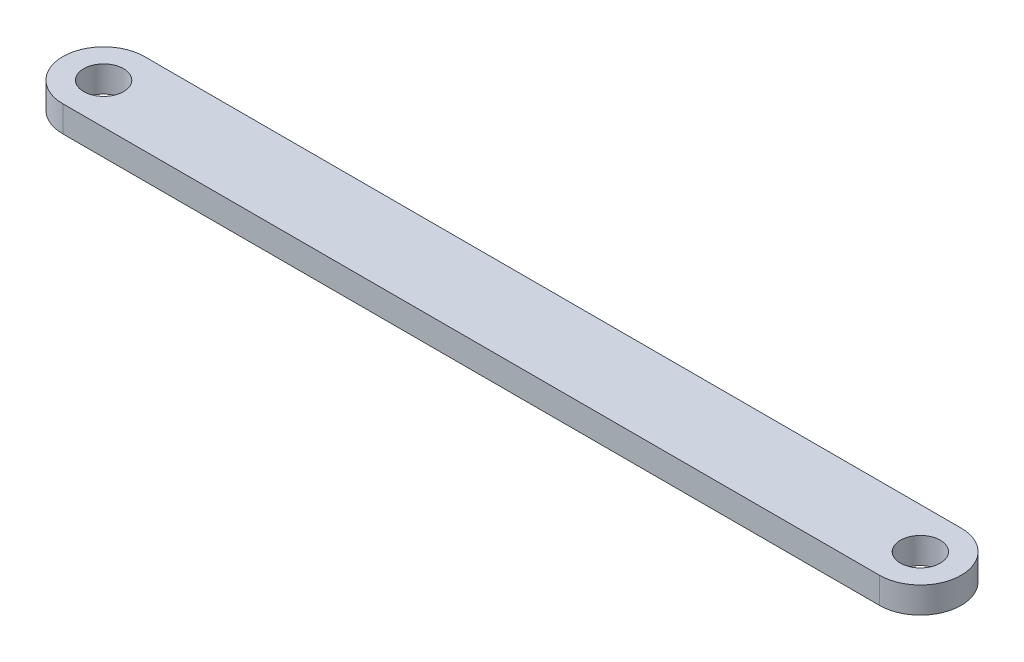
from build123d import *

# Parameters (mm, degrees)
SKETCH_1_R      = 6.1
EXTRUDE_1_DEPTH = 8


with BuildPart() as part:
    # 草图1 → 凸台-拉伸1 (new body)
    with BuildSketch(Plane(origin=(0, 0, 0), x_dir=(1, 0, 0), z_dir=(0, 1, 0))):
        with BuildLine():
            Line((0, 12.5), (250, 12.5))
            ThreePointArc((250, 12.5), (262.5, 0), (250, -12.5))
            Line((250, -12.5), (0, -12.5))
            ThreePointArc((0, -12.5), (-12.5, 0), (0, 12.5))
        make_face()
        with Locations(Location((0, 0, 0), (0, 0, 270))):
            Circle(SKETCH_1_R, mode=Mode.SUBTRACT)
        with Locations(Location((250, 0, 0), (0, 0, 270))):
            Circle(SKETCH_1_R, mode=Mode.SUBTRACT)
    extrude(amount=EXTRUDE_1_DEPTH)


solid = part.part
